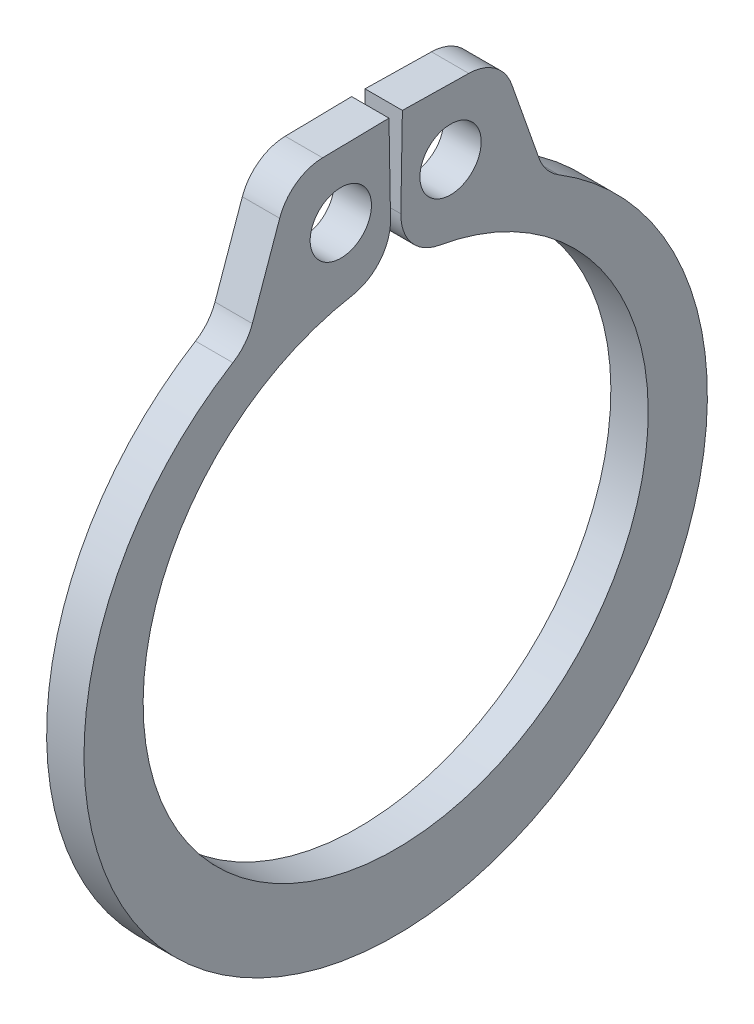
from build123d import *

# Parameters (mm, degrees)
BOSS_EXTRUDE1_DEPTH      = 0.3175
BOSS_EXTRUDE1_DEPTH_BACK = 0.3175
SKETCH3_R                = 0.5207
FILLET1_R                = 0.7874


with BuildPart() as part:
    # Sketch3 → Boss-Extrude1 (new, two sides: drawn at the far end of the back side and taken through both)
    with BuildSketch(Plane(origin=(0, 0, 0), x_dir=(0, 0, -1), z_dir=(1, 0, 0)).offset(-BOSS_EXTRUDE1_DEPTH_BACK)):
        with BuildLine():
            Line((-1.790070495, 6.49754857), (-2.532309488, 4.3891842))
            ThreePointArc((-2.532309488, 4.3891842), (0, -5.5626), (2.532309488, 4.3891842))
            Line((2.532309488, 4.3891842), (1.790070495, 6.49754857))
            Line((1.790070495, 6.49754857), (0.113925819, 6.526805784))
            Line((0.113925819, 6.526805784), (0.0749162, 4.291946216))
            ThreePointArc((0.0749162, 4.291946216), (0, -4.2926), (-0.0749162, 4.291946216))
            Line((-0.0749162, 4.291946216), (-0.113925819, 6.526805784))
            Line((-0.113925819, 6.526805784), (-1.790070495, 6.49754857))
        make_face()
        with Locations((-0.932493347, 5.394747393)):
            Circle(SKETCH3_R, mode=Mode.SUBTRACT)
        with Locations((0.932493347, 5.394747393)):
            Circle(SKETCH3_R, mode=Mode.SUBTRACT)
    extrude(amount=BOSS_EXTRUDE1_DEPTH + BOSS_EXTRUDE1_DEPTH_BACK)

    # Fillet1
    fillet1_edges = [part.edges().sort_by_distance(p)[0] for p in [
        (0, 4.3891842, 2.532309488),
        (0, 6.49754857, 1.790070495),
        (0, 4.291946216, 0.0749162),
        (0, 4.291946216, -0.0749162),
        (0, 6.49754857, -1.790070495),
        (0, 4.3891842, -2.532309488),
    ]]
    fillet(fillet1_edges, radius=FILLET1_R)


solid = part.part
